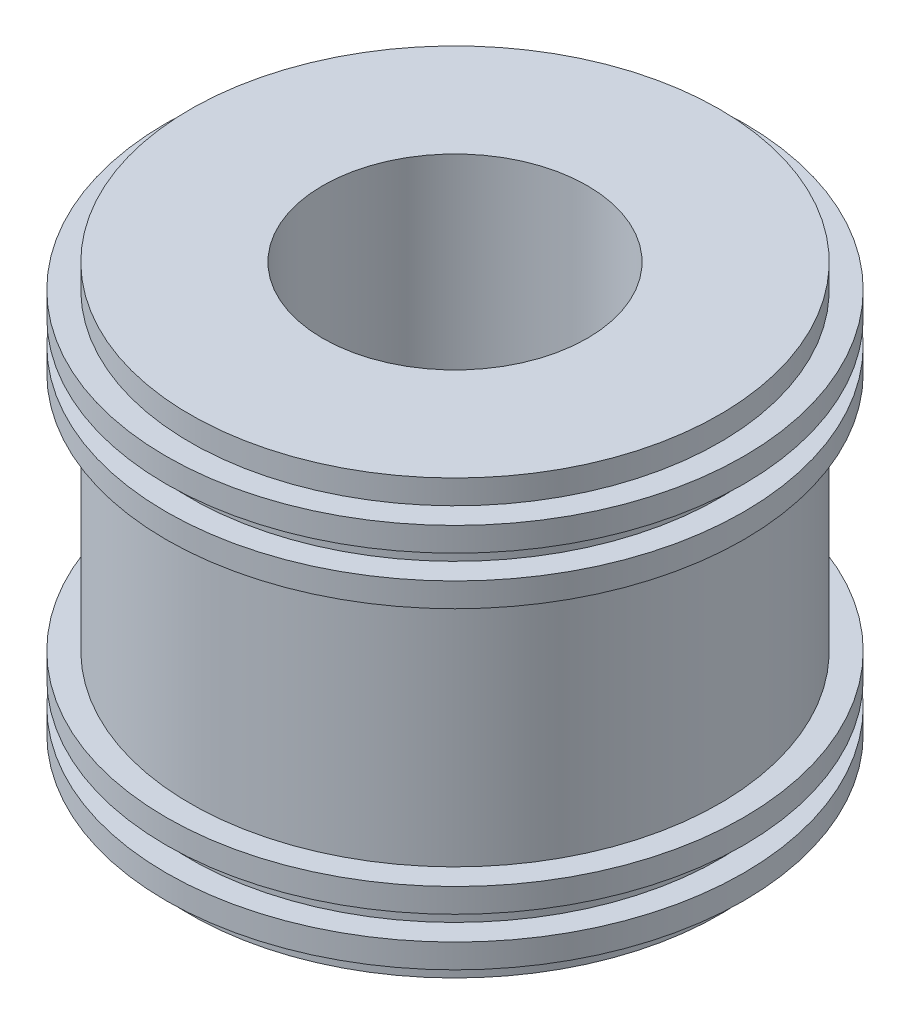
from build123d import *


with BuildPart() as part:
    # Esquisse1 → Révolution1 (revolve)
    with BuildSketch(Plane.XY, mode=Mode.PRIVATE) as r_volution1_sk:
        Polygon((22, 12), (24, 12), (24, 10), (22, 10), (22, -10), (24, -10), (24, -12), (22, -12), (22, -14), (24, -14), (24, -16), (22, -16), (22, -18), (11, -18), (11, 18), (22, 18), (22, 16), (24, 16), (24, 14), (22, 14), align=None)
    revolve(r_volution1_sk.sketch.rotate(Axis((0, 0, 0), (0, 1, 0)), 90), axis=Axis((0, 0, 0), (0, 1, 0)))


solid = part.part
